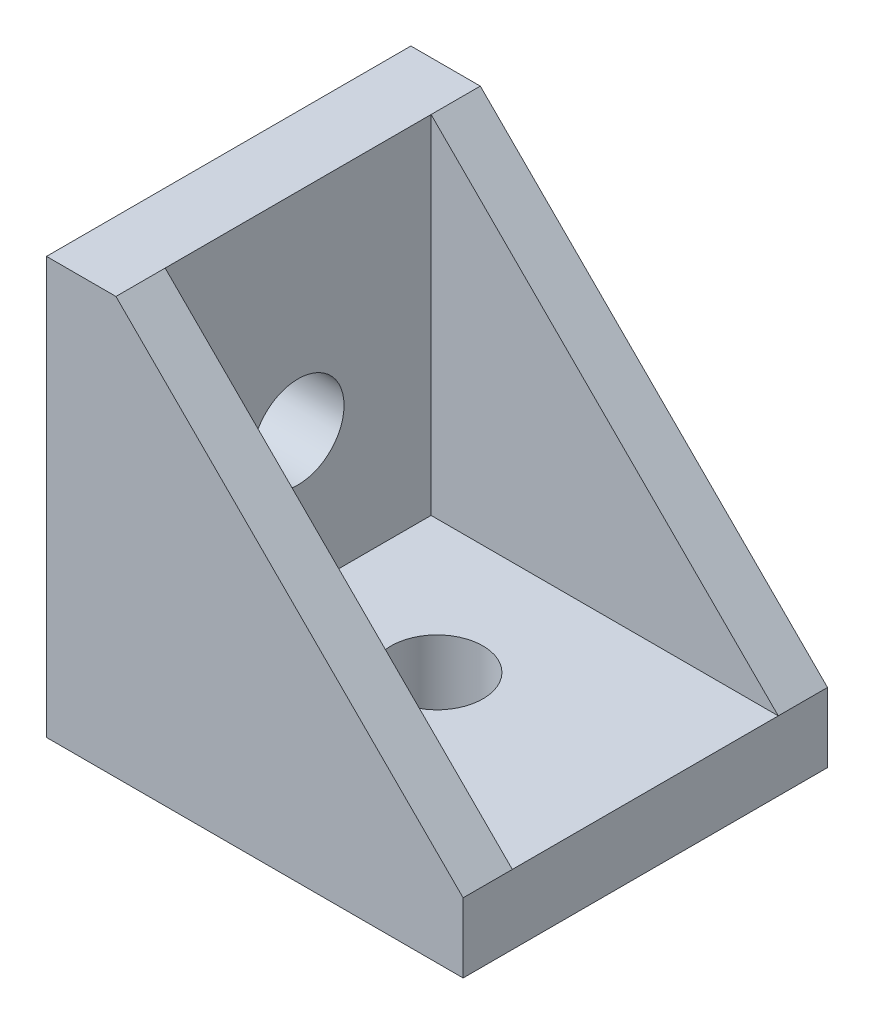
from build123d import *

# Parameters (mm, degrees)
BODY_DEPTH   = 33.32
POCKET_DEPTH = 24.32
SKETCH3_R    = 4.2
HOLESX_DEPTH = 6.35
SKETCH4_R    = 4.2
HOLESY_DEPTH = 6.35


with BuildPart() as part:
    # Sketch1 → Body (new body)
    with BuildSketch(Plane.XY.offset(-16.66)):
        Polygon((0, 0), (38.1, 0), (38.1, 6.35), (6.35, 38.1), (0, 38.1), align=None)
    extrude(amount=BODY_DEPTH)

    # Sketch2 → Pocket (cut)
    with BuildSketch(Plane.XY.offset(12.16)):
        Polygon((6.35, 6.35), (48.1, 6.35), (6.35, 48.1), align=None)
    extrude(amount=-POCKET_DEPTH, mode=Mode.SUBTRACT)

    # Sketch3 → HolesX (cut)
    with BuildSketch(Plane(origin=(0, 6.35, 0), x_dir=(1, 0, 0), z_dir=(0, 1, 0))):
        with Locations(Location((19.05, 0, 0), (0, 0, 270))):
            Circle(SKETCH3_R)
    extrude(amount=-HOLESX_DEPTH, mode=Mode.SUBTRACT)

    # Sketch4 → HolesY (cut)
    with BuildSketch(Plane(origin=(6.35, 0, 0), x_dir=(0, 0, -1), z_dir=(1, 0, 0))):
        with Locations((0, 19.05)):
            Circle(SKETCH4_R)
    extrude(amount=-HOLESY_DEPTH, mode=Mode.SUBTRACT)


solid = part.part
